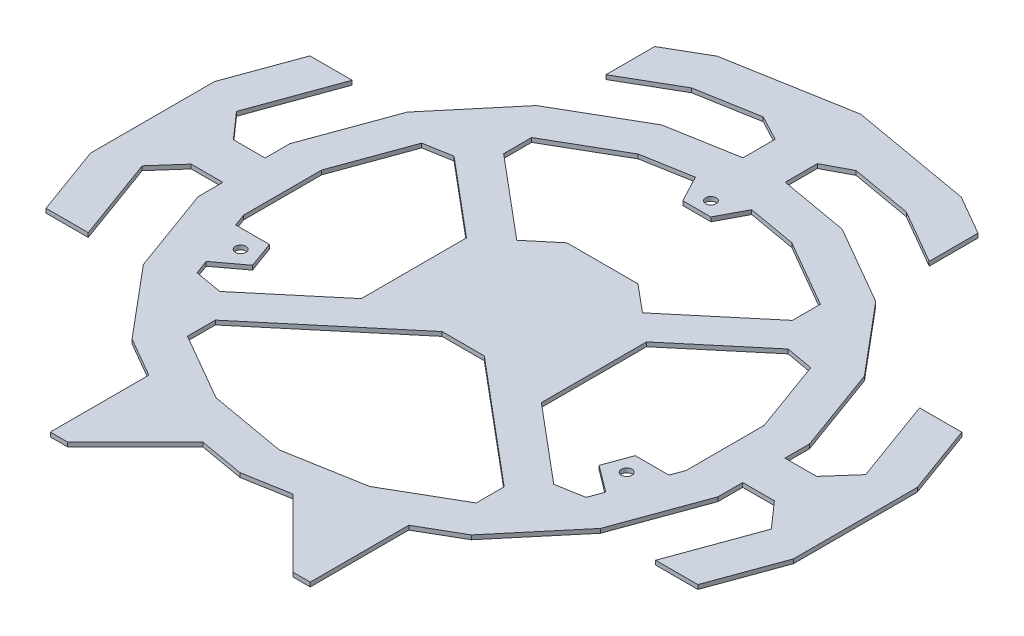
from build123d import *

# Parameters (mm, degrees)
BOSS_EXTRUDE1_DEPTH    = 1.2
BOSS_EXTRUDE17_DEPTH   = 1.2
BOSS_EXTRUDE17_2_DEPTH = 1.2
BOSS_EXTRUDE17_3_DEPTH = 1.2
SKETCH18_W             = 18
SKETCH18_H             = 12
BOSS_EXTRUDE18_DEPTH   = 1.2
BOSS_EXTRUDE19_DEPTH   = 1.2
BOSS_EXTRUDE20_DEPTH   = 1.2
BOSS_EXTRUDE21_DEPTH   = 1.2
BOSS_EXTRUDE22_DEPTH   = 1.2
BOSS_EXTRUDE23_DEPTH   = 1.2
BOSS_EXTRUDE26_DEPTH   = 1.2
BOSS_EXTRUDE29_DEPTH   = 1.2
BOSS_EXTRUDE30_DEPTH   = 1.2
BOSS_EXTRUDE31_DEPTH   = 1.2
SKETCH37_R             = 1.5
CUT_EXTRUDE1_DEPTH     = 1.2
SKETCH38_R             = 1.5
CUT_EXTRUDE2_DEPTH     = 1.2
BOSS_EXTRUDE32_DEPTH   = 1.2


with BuildPart() as part:
    # Sketch1 → Boss-Extrude1 (new body)
    with BuildSketch(Plane(origin=(0, 0, 0), x_dir=(1, 0, 0), z_dir=(0, 1, 0))):
        Polygon((0, 75), (-25.651510749, 70.476946559), (-48.209070726, 57.453333234), (-64.951905284, 37.5), (-73.860581476, 13.023613325), (-73.860581476, -13.023613325), (-64.951905284, -37.5), (-48.209070726, -57.453333234), (-25.651510749, -70.476946559), (0, -75), (25.651510749, -70.476946559), (48.209070726, -57.453333234), (64.951905284, -37.5), (73.860581476, -13.023613325), (73.860581476, 13.023613325), (64.951905284, 37.5), (48.209070726, 57.453333234), (25.651510749, 70.476946559), align=None)
        Polygon((0, 63.830307269), (-21.831250841, 59.980868723), (-41.029330635, 48.896852186), (-55.278667627, 31.915153635), (-62.860581476, 11.084016537), (-62.860581476, -11.084016537), (-55.278667627, -31.915153635), (-41.029330635, -48.896852186), (-21.831250841, -59.980868723), (0, -63.830307269), (21.831250841, -59.980868723), (41.029330635, -48.896852186), (55.278667627, -31.915153635), (62.860581476, -11.084016537), (62.860581476, 11.084016537), (55.278667627, 31.915153635), (41.029330635, 48.896852186), (21.831250841, 59.980868723), align=None, mode=Mode.SUBTRACT)
    extrude(amount=BOSS_EXTRUDE1_DEPTH)



with BuildPart() as body_2:
    # Sketch15 → Boss-Extrude17 (new body)
    with BuildSketch(Plane.XZ):
        Polygon((0, -101.401091909), (34.681215988, -95.285857807), (36.930290738, -93.987353894), (36.930290738, -84.749749587), (31.902845145, -87.652346653), (0, -93.277679014), (-31.902845145, -87.652346653), (-36.930290738, -84.749749587), (-36.930290738, -93.987353894), (-34.681215988, -95.285857807), align=None)
    extrude(amount=-BOSS_EXTRUDE17_DEPTH)


with BuildPart() as body_3:
    # Sketch15 → Boss-Extrude17 2 (new body)
    with BuildSketch(Plane.XZ):
        Polygon((92.620527368, -37.5), (99.860581476, -17.608114823), (99.860581476, 17.608114823), (92.620527368, 37.5), (84.107105188, 37.5), (91.860581476, 16.197498978), (91.860581476, -16.197498978), (84.107105188, -37.5), align=None)
    extrude(amount=-BOSS_EXTRUDE17_2_DEPTH)


with BuildPart() as body_4:
    # Sketch15 → Boss-Extrude17 3 (new body)
    with BuildSketch(Plane.XZ):
        Polygon((-92.620527368, 37.5), (-99.860581476, 17.608114823), (-99.860581476, -17.608114823), (-92.620527368, -37.5), (-84.107105188, -37.5), (-91.860581476, -16.197498978), (-91.860581476, 16.197498978), (-84.107105188, 37.5), align=None)
    extrude(amount=-BOSS_EXTRUDE17_3_DEPTH)


with BuildPart() as part_1:
    add(part.part)

    add(body_2.part)  # Boss-Extrude18 merges body 2

    add(body_3.part)  # Boss-Extrude18 merges body 3

    add(body_4.part)  # Boss-Extrude18 merges body 4
    # Sketch18 → Boss-Extrude18 (add)
    with BuildSketch(Plane.XZ):
        with Locations((-82.860581476, 0)):
            Rectangle(SKETCH18_W, SKETCH18_H)
        with Locations((82.860581476, 0)):
            Rectangle(SKETCH18_W, SKETCH18_H)
        Polygon((-6, -73.942038116), (-6, -92.21971713), (0, -93.277679014), (6, -92.21971713), (6, -73.942038116), (0, -75), align=None)
    extrude(amount=-BOSS_EXTRUDE18_DEPTH)

    # Sketch19 → Boss-Extrude19 (add)
    with BuildSketch(Plane.XZ):
        Polygon((-91.860581476, 16.197498978), (-82.860581476, 6), (-91.860581476, 6), align=None)
        Polygon((-91.860581476, -16.197498978), (-82.860581476, -6), (-91.860581476, -6), align=None)
        Polygon((91.860581476, 16.197498978), (82.860581476, 6), (91.860581476, 6), align=None)
        Polygon((91.860581476, -16.197498978), (82.860581476, -6), (91.860581476, -6), align=None)
        Polygon((18.951422573, -89.936031892), (6, -83.080877623), (6, -92.21971713), align=None)
        Polygon((-6, -83.080877623), (-6, -92.21971713), (-18.951422573, -89.936031892), align=None)
    extrude(amount=-BOSS_EXTRUDE19_DEPTH)

    # Sketch20 → Boss-Extrude20 (add)
    with BuildSketch(Plane.XZ):
        Polygon((-36.930290738, 63.965139896), (-36.930290738, 91.965139896), (-32.052421992, 91.965139896), (-12.825755375, 72.738473279), (-25.651510749, 70.476946559), align=None)
        Polygon((36.930290738, 63.965139896), (36.930290738, 91.965139896), (32.052421992, 91.965139896), (12.825755375, 72.738473279), (25.651510749, 70.476946559), align=None)
    extrude(amount=-BOSS_EXTRUDE20_DEPTH)

    # Sketch23 → Boss-Extrude21 (add)
    with BuildSketch(Plane(origin=(0, 1.2, 0), x_dir=(1, 0, 0), z_dir=(0, 1, 0))):
        Polygon((-92.620527368, 37.5), (-80.620527368, 37.5), (-89.392030332, 13.400493671), (-89.392030332, -13.400493671), (-80.620527368, -37.5), (-92.620527368, -37.5), (-99.860581476, -17.608114823), (-99.860581476, 17.608114823), align=None)
        Polygon((80.620527368, -37.5), (89.392030332, -13.400493671), (89.392030332, 13.400493671), (80.620527368, 37.5), (92.620527368, 37.5), (99.860581476, 17.608114823), (99.860581476, -17.608114823), (92.620527368, -37.5), align=None)
    extrude(amount=-BOSS_EXTRUDE21_DEPTH)

    # Sketch24 → Boss-Extrude22 (add)
    with BuildSketch(Plane(origin=(0, 1.2, 0), x_dir=(1, 0, 0), z_dir=(0, 1, 0))):
        Polygon((-36.930290738, 93.987353894), (-36.930290738, 80.130947434), (-30.513659724, 83.835591077), (-13.195234763, 86.889296661), (13.195234763, 86.889296661), (30.513659724, 83.835591077), (36.930290738, 80.130947434), (36.930290738, 93.987353894), (34.681215988, 95.285857807), (0, 101.401091909), (-34.681215988, 95.285857807), align=None)
    extrude(amount=-BOSS_EXTRUDE22_DEPTH)

    # Sketch26 → Boss-Extrude23 (add)
    with BuildSketch(Plane(origin=(0, 1.2, 0), x_dir=(1, 0, 0), z_dir=(0, 1, 0))):
        Polygon((-36.930290738, 93.987353894), (-45.930290738, 88.791201472), (-45.930290738, 74.934795011), (-36.930290738, 80.130947434), align=None)
        Polygon((36.930290738, 93.987353894), (45.930290738, 88.791201472), (45.930290738, 74.934795011), (36.930290738, 80.130947434), align=None)
    extrude(amount=-BOSS_EXTRUDE23_DEPTH)

    # Sketch27 → Boss-Extrude26 (add)
    with BuildSketch(Plane.XZ):
        Polygon((-44.940061082, 44.236225126), (0, 6.527036447), (44.940061082, 44.236225126), (51.367937179, 36.575780695), (7.778619134, 0), (51.367937179, -36.575780695), (44.940061082, -44.236225126), (0, -6.527036447), (-44.940061082, -44.236225126), (-51.367937179, -36.575780695), (-7.778619134, 0), (-51.367937179, 36.575780695), align=None)
    extrude(amount=-BOSS_EXTRUDE26_DEPTH)

    # Sketch31 → Boss-Extrude29 (add)
    with BuildSketch(Plane.XZ):
        Polygon((-10.098423643, -28), (10.098423643, -28), (25.590481458, -15.054072893), (25.590481458, 14.945927107), (6, 11.561634234), (-6, 11.561634234), (-25.590481458, 14.945927107), (-25.590481458, -15.054072893), align=None)
    extrude(amount=-BOSS_EXTRUDE29_DEPTH)

    # Sketch32 → Boss-Extrude30 (add)
    with BuildSketch(Plane(origin=(0, 1.2, 0), x_dir=(1, 0, 0), z_dir=(0, 1, 0))):
        Polygon((-41.029330635, 48.896852186), (-41.029330635, 40.95473265), (-44.940061082, 44.236225126), align=None)
        Polygon((41.029330635, 48.896852186), (41.029330635, 40.95473265), (44.940061082, 44.236225126), align=None)
        Polygon((44.940061082, -44.236225126), (41.029330635, -48.896852186), (41.029330635, -40.95473265), align=None)
        Polygon((-41.029330635, -48.896852186), (-41.029330635, -40.95473265), (-44.940061082, -44.236225126), align=None)
    extrude(amount=-BOSS_EXTRUDE30_DEPTH)

    # Sketch34 → Boss-Extrude31 (add)
    with BuildSketch(Plane(origin=(0, 1.2, 0), x_dir=(1, 0, 0), z_dir=(0, 1, 0))):
        Polygon((8, 62.419691424), (4, 54.830307269), (-4, 54.830307269), (-8, 62.419691424), (0, 63.830307269), align=None)
        Polygon((-61.55807149, -14.662633313), (-56.769789483, -27.818330004), (-49.244310391, -22.180174279), (-50.612390964, -18.421403796), (-51.980471537, -14.662633313), align=None)
        Polygon((50.612390964, -18.421403796), (49.244310391, -22.180174279), (56.769789483, -27.818330004), (61.55807149, -14.662633313), (51.980471537, -14.662633313), align=None)
    extrude(amount=-BOSS_EXTRUDE31_DEPTH)

    # Sketch37 → Cut-Extrude1 (cut)
    with BuildSketch(Plane(origin=(0, 1.2, 0), x_dir=(1, 0, 0), z_dir=(0, 1, 0))):
        with Locations(Location((-54.84814578, -19.96309247, 0), (0, 0, 270))):
            Circle(SKETCH37_R)
        with Locations(Location((54.84814578, -19.96309247, 0), (0, 0, 270))):
            Circle(SKETCH37_R)
    extrude(amount=-CUT_EXTRUDE1_DEPTH, mode=Mode.SUBTRACT)

    # Sketch38 → Cut-Extrude2 (cut)
    with BuildSketch(Plane(origin=(0, 1.2, 0), x_dir=(1, 0, 0), z_dir=(0, 1, 0))):
        with Locations(Location((0, 58.81204127, 0), (0, 0, 270))):
            Circle(SKETCH38_R)
    extrude(amount=-CUT_EXTRUDE2_DEPTH, mode=Mode.SUBTRACT)

    # Sketch39 → Boss-Extrude32 (add)
    with BuildSketch(Plane(origin=(0, 1.2, 0), x_dir=(1, 0, 0), z_dir=(0, 1, 0))):
        Polygon((-51.367937179, 36.575780695), (-47.457206732, 33.294288219), (-55.278667627, 31.915153635), align=None)
        Polygon((51.367937179, 36.575780695), (55.278667627, 31.915153635), (47.457206732, 33.294288219), align=None)
        Polygon((51.367937179, -36.575780695), (55.278667627, -31.915153635), (47.457206732, -33.294288219), align=None)
        Polygon((-47.457206732, -33.294288219), (-51.367937179, -36.575780695), (-55.278667627, -31.915153635), align=None)
    extrude(amount=-BOSS_EXTRUDE32_DEPTH)


solid = part_1.part
